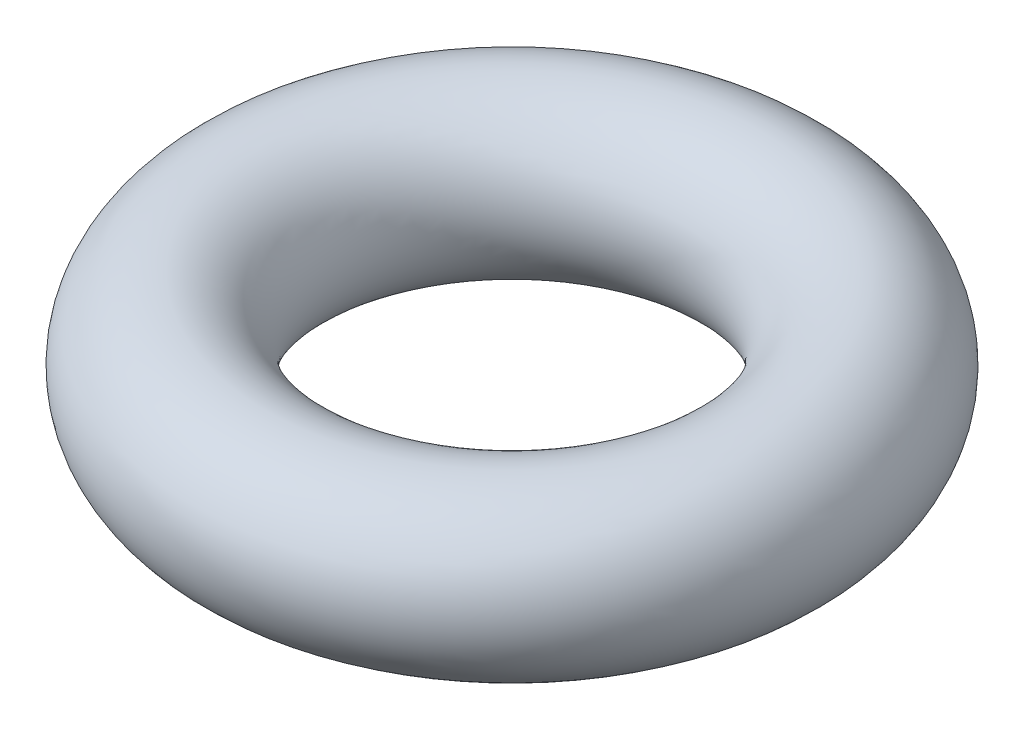
from build123d import *

# Parameters (mm, degrees)
SKETCH1_R = 0.79375


with BuildPart() as part:
    # Sketch1 → Revolve1 (revolve)
    with BuildSketch(Plane.XY):
        with Locations((2.3876, 0)):
            Circle(SKETCH1_R)
    revolve(axis=Axis((0, -44.218008751, 0), (0, 1, 0)))


solid = part.part
